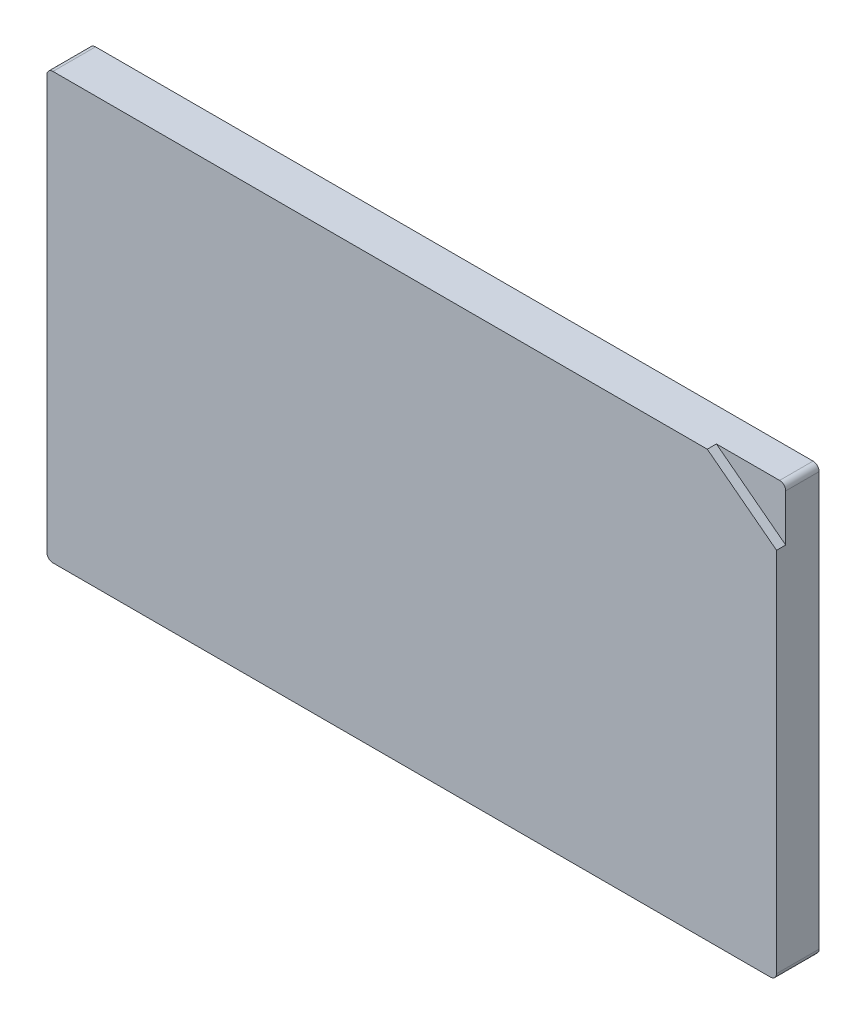
from build123d import *

# Parameters (mm, degrees)
SKETCH_1_W          = 12
SKETCH_1_H          = 7
EXTRUDE_1_DEPTH     = 0.7
CUT_EXTRUDE_1_DEPTH = 0.15
FILLET_1_R          = 0.1


with BuildPart() as part:
    # 草图1 → 凸台-拉伸1 (new body)
    with BuildSketch(Plane.XY):
        with Locations((-1.514563107, 1.412621359)):
            Rectangle(SKETCH_1_W, SKETCH_1_H)
    extrude(amount=EXTRUDE_1_DEPTH)

    # 草图2 → 切除-拉伸1 (cut)
    with BuildSketch(Plane.XY.offset(0.7)):
        Polygon((3.346075687, 4.912621359), (4.485436893, 4.042359893), (4.485436893, 4.912621359), align=None)
    extrude(amount=-CUT_EXTRUDE_1_DEPTH, mode=Mode.SUBTRACT)

    # 圆角1
    fillet_1_edges = [part.edges().sort_by_distance(p)[0] for p in [
        (4.485436893, 4.912621359, 0.275),
        (-7.514563107, 4.912621359, 0.35),
        (4.485436893, -2.087378641, 0.35),
        (-7.514563107, -2.087378641, 0.35),
    ]]
    fillet(fillet_1_edges, radius=FILLET_1_R)


solid = part.part
